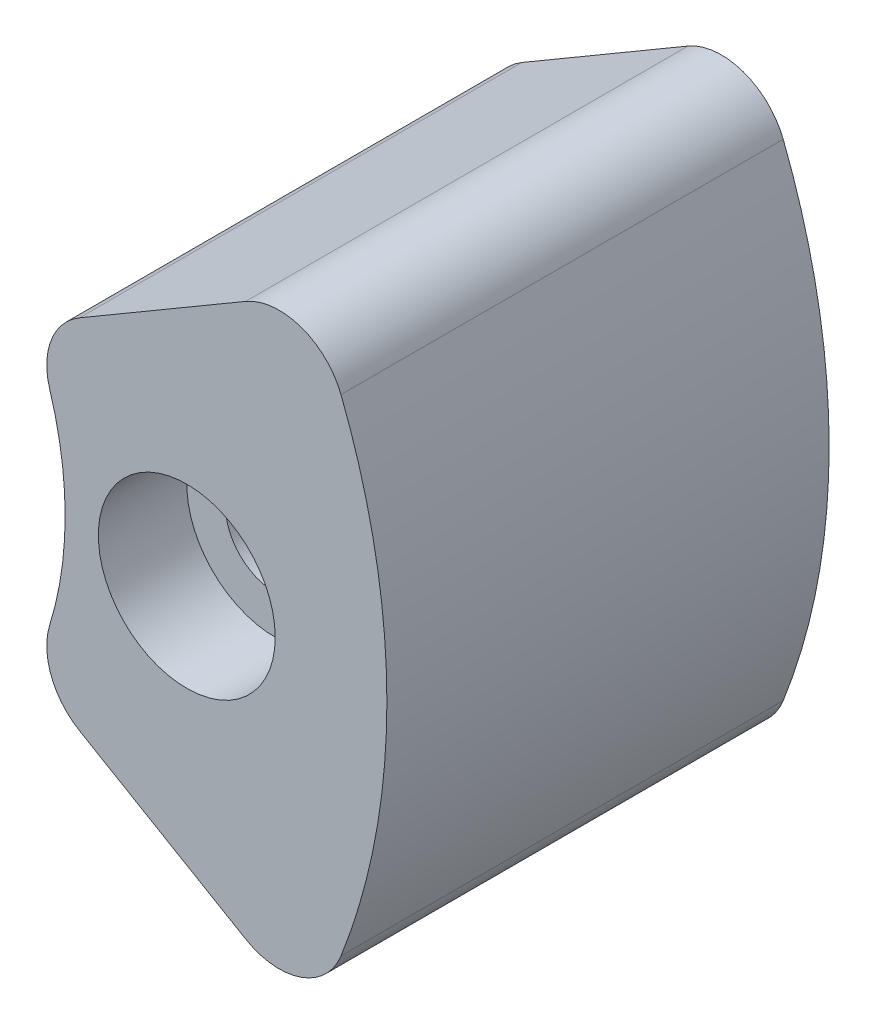
from build123d import *

# Parameters (mm, degrees)
CORPO_DEPTH                 = 20
REBAIXO_SHCS_M4_D           = 4.5
REBAIXO_SHCS_M4_DEPTH       = 30
REBAIXO_SHCS_M4_CBORE_D     = 8
REBAIXO_SHCS_M4_CBORE_DEPTH = 4
REBAIXO_SHCS_M4_TIP         = 1.351936393


with BuildPart() as part:
    # Sketch1 → Corpo (new body)
    with BuildSketch(Plane.XY):
        with BuildLine():
            Line((16.252058195, 8.088672021), (23.764502557, 12.488672021))
            ThreePointArc((23.764502557, 12.488672021), (26.263743802, 12.734356122), (28.074119126, 10.993922652))
            ThreePointArc((28.074119126, 10.993922652), (30.15, 0), (28.074119126, -10.993922652))
            ThreePointArc((28.074119126, -10.993922652), (26.263743802, -12.734356122), (23.764502557, -12.488672021))
            Line((23.764502557, -12.488672021), (16.252058195, -8.088672021))
            ThreePointArc((16.252058195, -8.088672021), (14.971668435, -6.585929552), (14.902386515, -4.612903226))
            ThreePointArc((14.902386515, -4.612903226), (15.6, 0), (14.902386515, 4.612903226))
            ThreePointArc((14.902386515, 4.612903226), (14.971668435, 6.585929552), (16.252058195, 8.088672021))
        make_face()
    extrude(amount=CORPO_DEPTH)

    # Rebaixo SHCS M4
    with Locations(Plane.XY.offset(20)):
        with Locations((21.1, 0)):
            CounterBoreHole(REBAIXO_SHCS_M4_D / 2, REBAIXO_SHCS_M4_CBORE_D / 2, REBAIXO_SHCS_M4_CBORE_DEPTH, depth=REBAIXO_SHCS_M4_DEPTH)
            with Locations((0, 0, -(REBAIXO_SHCS_M4_DEPTH + REBAIXO_SHCS_M4_TIP / 2))):  # 118° drill point
                Cone(0, REBAIXO_SHCS_M4_D / 2, REBAIXO_SHCS_M4_TIP, mode=Mode.SUBTRACT)


solid = part.part
